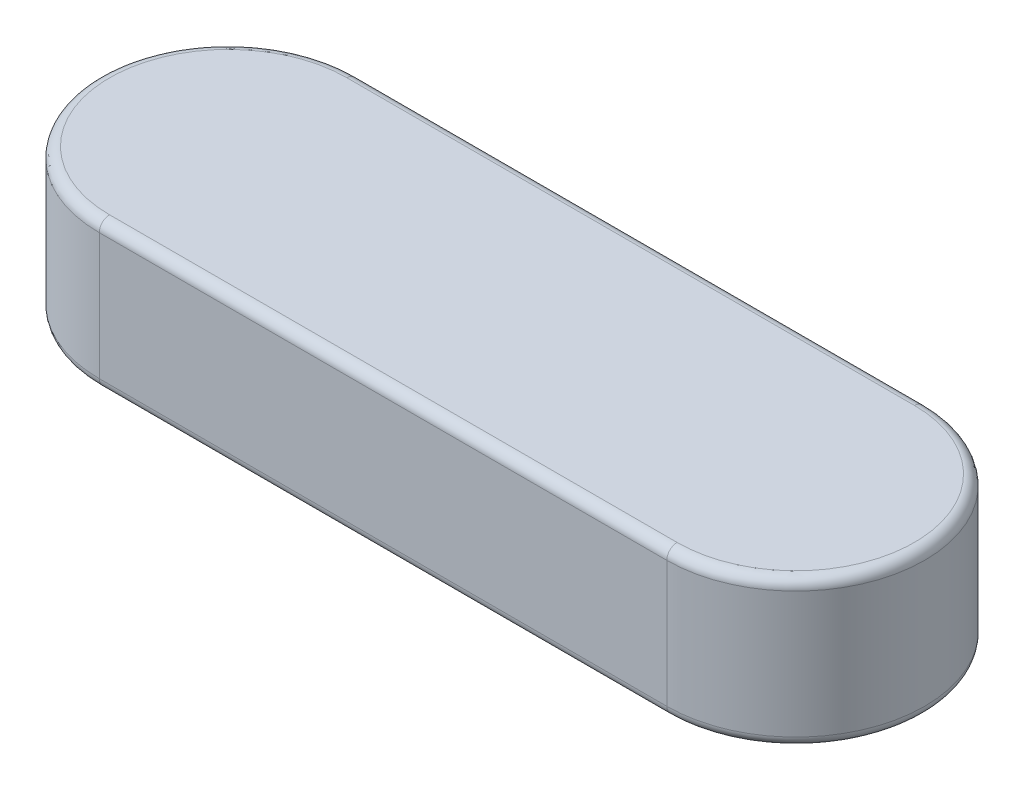
from build123d import *

# Parameters (mm, degrees)
EXTRUDE1_DEPTH = 5.7
FILLET1_R      = 0.4


with BuildPart() as part:
    # Sketch1 → Extrude1 (new body)
    with BuildSketch(Plane(origin=(0, 0, 0), x_dir=(1, 0, 0), z_dir=(0, 1, 0))):
        with BuildLine():
            Line((-22, 5), (0, 5))
            ThreePointArc((0, 5), (5, 0), (0, -5))
            Line((0, -5), (-22, -5))
            ThreePointArc((-22, -5), (-27, 0), (-22, 5))
        make_face()
    extrude(amount=EXTRUDE1_DEPTH)

    # Fillet1
    fillet1_edges = [part.edges().sort_by_distance(p)[0] for p in [
        (5, 5.7, 0),
        (-11, 5.7, -5),
        (-27, 5.7, 0),
        (-11, 0, -5),
        (5, 0, 0),
        (-11, 0, 5),
        (-27, 0, 0),
        (-11, 5.7, 5),
    ]]
    fillet(fillet1_edges, radius=FILLET1_R)


solid = part.part
